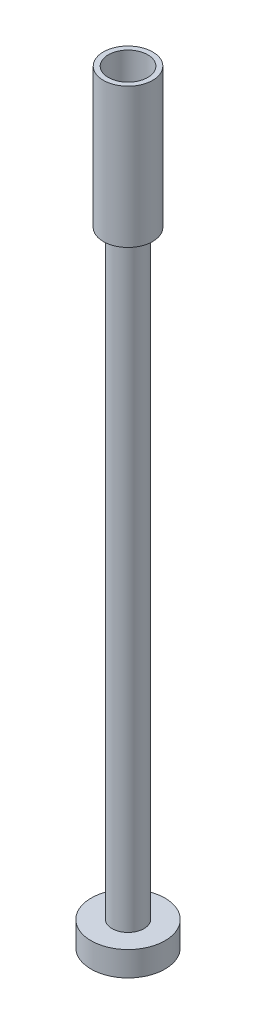
from build123d import *

# Parameters (mm, degrees)
SKETCH1_R           = 0.8255
BOSS_EXTRUDE1_DEPTH = 38.1
SKETCH3_R           = 1.905
BOSS_EXTRUDE2_DEPTH = 1.27
SKETCH6_R           = 1.27
BOSS_EXTRUDE5_DEPTH = 7.200607359
SKETCH8_R           = 1.016
CUT_EXTRUDE2_DEPTH  = 2.032
SKETCH9_W           = 0.40474265
SKETCH9_H           = 1.016
CUT_EXTRUDE3_DEPTH  = 0.762


with BuildPart() as part:
    # Sketch1 → Boss-Extrude1 (new body)
    with BuildSketch(Plane(origin=(0, 0, 0), x_dir=(1, 0, 0), z_dir=(0, 1, 0))):
        with Locations(Location((-5.56320867, -0.435127994, 0), (0, 0, 90))):
            Circle(SKETCH1_R)
    extrude(amount=BOSS_EXTRUDE1_DEPTH)

    # Sketch3 → Boss-Extrude2 (add)
    with BuildSketch(Plane.XZ):
        with Locations(Location((-5.56320867, 0.435127994, 0), (0, 0, 270))):
            Circle(SKETCH3_R)
    extrude(amount=BOSS_EXTRUDE2_DEPTH)

    # Sketch6 → Boss-Extrude5 (add)
    with BuildSketch(Plane(origin=(0, 38.1, 0), x_dir=(1, 0, 0), z_dir=(0, 1, 0))):
        with Locations(Location((-5.56320867, -0.435127994, 0), (0, 0, 270))):
            Circle(SKETCH6_R)
    extrude(amount=-BOSS_EXTRUDE5_DEPTH)

    # Sketch8 → Cut-Extrude2 (cut)
    with BuildSketch(Plane(origin=(0, 38.1, 0), x_dir=(1, 0, 0), z_dir=(0, 1, 0))):
        with Locations(Location((-5.56320867, -0.435127994, 0), (0, 0, 270))):
            Circle(SKETCH8_R)
    extrude(amount=-CUT_EXTRUDE2_DEPTH, mode=Mode.SUBTRACT)

    # Sketch9 → Cut-Extrude3 (cut)
    with BuildSketch(Plane.ZY.offset(6.83320867)):
        with Locations((0.202371325, 32.386805083)):
            Rectangle(SKETCH9_W, SKETCH9_H)
    extrude(amount=-CUT_EXTRUDE3_DEPTH, mode=Mode.SUBTRACT)


solid = part.part
